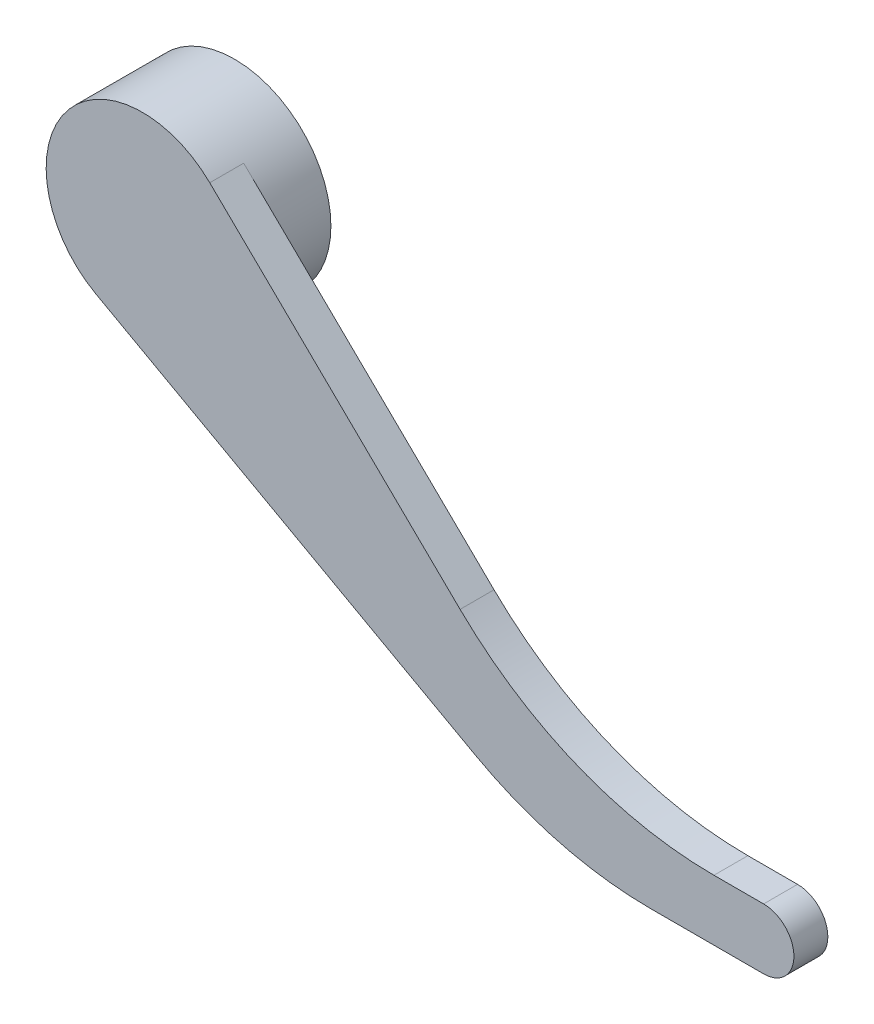
from build123d import *

# Parameters (mm, degrees)
BOSS_EXTRUDE1_DEPTH = 1.4
BOSS_EXTRUDE2_START = -3.8
SKETCH2_R           = 3.975
SKETCH2_R_2         = 2.475
BOSS_EXTRUDE2_DEPTH = 3.8
BOSS_EXTRUDE4_DEPTH = 2.4
CIRPATTERN1_COUNT   = 60


with BuildPart() as part:
    # Sketch1 → Boss-Extrude1 (new body)
    with BuildSketch(Plane.XY):
        with BuildLine():
            Line((19.106400327, -1.235579), (8.776149708, 8.844928435))
            ThreePointArc((8.776149708, 8.844928435), (2.809198838, 8.370530097), (4.077720642, 2.520708826))
            Line((4.077720642, 2.520708826), (19.734263722, -6.129400656))
            ThreePointArc((19.734263722, -6.129400656), (23.242551331, -7.524823748), (26.98814809, -8))
            Line((26.98814809, -8), (31.632011236, -8))
            ThreePointArc((31.632011236, -8), (32.882011236, -6.75), (31.632011236, -5.5))
            Line((31.632011236, -5.5), (29.58243696, -5.5))
            ThreePointArc((29.58243696, -5.5), (23.927071587, -4.393050151), (19.106400327, -1.235579))
        make_face()
    extrude(amount=BOSS_EXTRUDE1_DEPTH)

    # Sketch2 → Boss-Extrude2 (add)
    with BuildSketch(Plane.XY.offset(1.4).offset(BOSS_EXTRUDE2_START)):
        with Locations(Location((6, 6, 0), (0, 0, 241.079715737))):
            Circle(SKETCH2_R)
        with Locations((6, 6)):
            Circle(SKETCH2_R_2, mode=Mode.SUBTRACT)
    extrude(amount=BOSS_EXTRUDE2_DEPTH)

    # Sketch3 → Boss-Extrude4 (add)
    with BuildSketch(Plane(origin=(0, 0, 0), x_dir=(-1, 0, 0), z_dir=(0, 0, -1))):
        Polygon((-5.691798909, 8.455735549), (-5.611121184, 8.342946492), (-5.498332127, 8.423624217), (-5.494697193, 8.445524247), (-5.688163974, 8.477635579), align=None)
    boss_extrude4 = extrude(amount=BOSS_EXTRUDE4_DEPTH)

    # CirPattern1: Boss-Extrude4 ×60 about axis
    cirpattern1_axis = Axis((6.0002051, 5.9987643, 0), (0, 0, 1))
    for i in range(1, CIRPATTERN1_COUNT):
        add(boss_extrude4.rotate(cirpattern1_axis, i * 360 / CIRPATTERN1_COUNT))


solid = part.part
